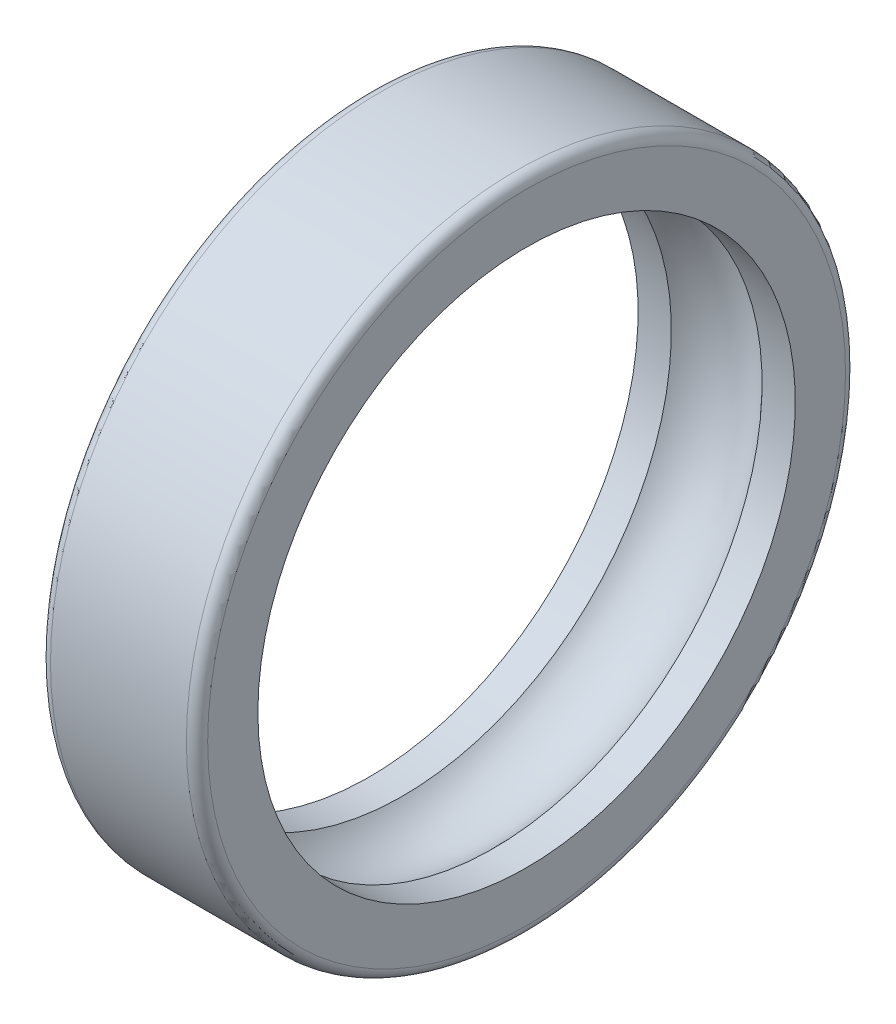
from build123d import *

# Parameters (mm, degrees)
FILLET1_R    = 2.1
SCALE1_SCALE = 0.193040386


with BuildPart() as part:
    # Sketch1 → Revolve1 (revolve)
    with BuildSketch(Plane.XY, mode=Mode.PRIVATE) as revolve1_sk:
        with BuildLine():
            Line((-15.5, 65), (15.5, 65))
            Line((15.5, 65), (15.5, 53))
            Line((15.5, 53), (8.94427191, 53))
            ThreePointArc((8.94427191, 53), (0, 57), (-8.94427191, 53))
            Line((-8.94427191, 53), (-15.5, 53))
            Line((-15.5, 53), (-15.5, 65))
        make_face()
    revolve(revolve1_sk.sketch.rotate(Axis((-25.358454362, 0, 0), (1, 0, 0)), 90), axis=Axis((-25.358454362, 0, 0), (1, 0, 0)))

    # Fillet1
    fillet1_edges = [part.edges().sort_by_distance(p)[0] for p in [
        (15.5, 0, -65),
        (-15.5, 0, -65),
    ]]
    fillet(fillet1_edges, radius=FILLET1_R)


with BuildPart() as part_1:
    # Scale1: scaled about (0, 0, 0)
    add(part.part.scale(SCALE1_SCALE))


solid = part_1.part
